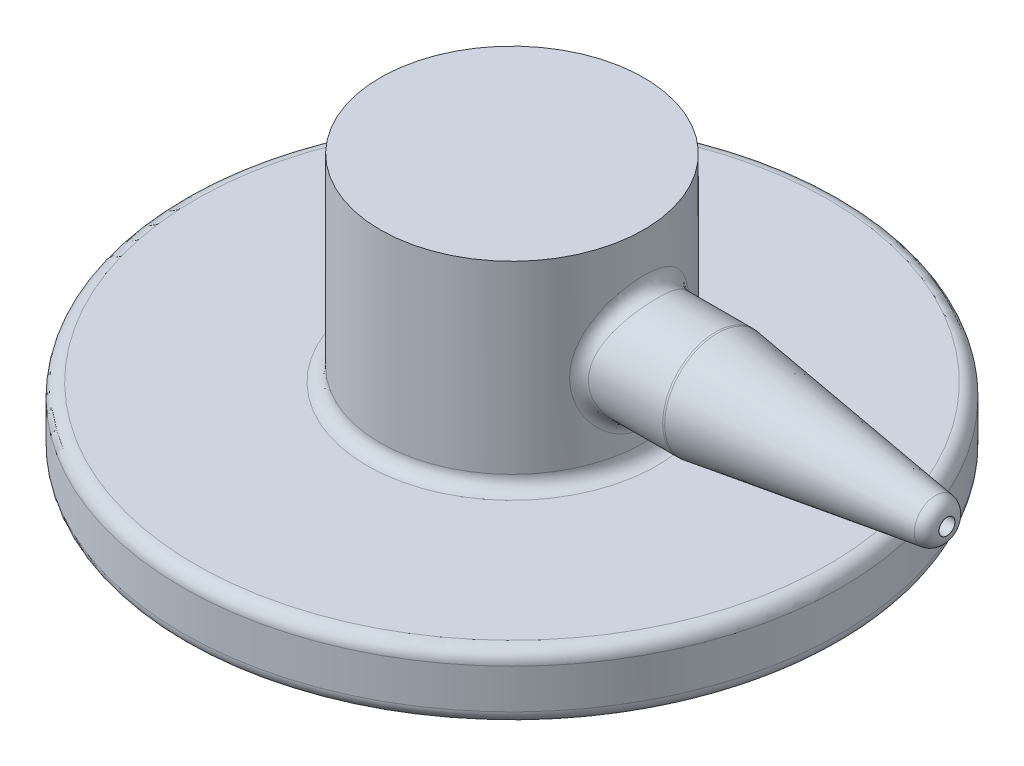
from build123d import *

# Parameters (mm, degrees)
SKETCH3_R               = 4
BOSS_EXTRUDE1_DEPTH     = 25
BOSS_EXTRUDE2_START     = 25
SKETCH3_5_R             = 3
BOSS_EXTRUDE2_DEPTH     = 8
FILLET1_R               = 1
CUT_EXTRUDE1_DEPTH      = 17
CUT_EXTRUDE1_DEPTH_BACK = 46.978255774
SKETCH15_R              = 1.8
FILLET3_R               = 1


with BuildPart() as part:
    # Sketch1 → Revolve1 (revolve)
    with BuildSketch(Plane.XY, mode=Mode.PRIVATE) as revolve1_sk:
        Polygon((0, 20), (0, 0), (25, 0), (25, 5), (10, 5), (10, 20), align=None)
    revolve(revolve1_sk.sketch.rotate(Axis((0, 20, 0), (0, -1, 0)), 90), axis=Axis((0, 20, 0), (0, -1, 0)))

    # Sketch3 → Boss-Extrude1 (add)
    with BuildSketch(Plane(origin=(0, 0, 0), x_dir=(0, 0, -1), z_dir=(1, 0, 0))):
        with Locations(Location((0, 12, 0), (0, 0, 180))):
            Circle(SKETCH3_R)
    extrude(amount=BOSS_EXTRUDE1_DEPTH)

    # Sketch3<5> → Boss-Extrude2 (add)
    with BuildSketch(Plane(origin=(0, 0, 0), x_dir=(0, 0, -1), z_dir=(1, 0, 0)).offset(BOSS_EXTRUDE2_START)):
        with Locations((0, 12)):
            Circle(SKETCH3_5_R)
    extrude(amount=BOSS_EXTRUDE2_DEPTH)

    # Fillet1
    fillet1_edges = [part.edges().sort_by_distance(p)[0] for p in [
        (0, 5, -25),
        (0, 0, -25),
    ]]
    fillet(fillet1_edges, radius=FILLET1_R)

    # Sketch11 → Cut-Revolve10 (revolve, cut)
    with BuildSketch(Plane.XY, mode=Mode.PRIVATE) as cut_revolve10_sk:
        with BuildLine():
            Line((0, 4), (0, 0))
            Line((0, 0), (22.072872435, 0))
            ThreePointArc((22.072872435, 0), (11.216213299, 2.992049146), (0, 4))
        make_face()
    revolve(cut_revolve10_sk.sketch.rotate(Axis((0, 0, 0), (0, 1, 0)), 90), axis=Axis((0, 0, 0), (0, 1, 0)), mode=Mode.SUBTRACT)

    # Sketch15 → Cut-Extrude1 (cut, two sides: drawn at the far end of the back side and taken through both)
    with BuildSketch(Plane(origin=(0, 0, 0), x_dir=(1, 0, 0), z_dir=(0, 1, 0)).offset(-CUT_EXTRUDE1_DEPTH_BACK)):
        with Locations(Location((0, 0, 0), (0, 0, 270))):
            Circle(SKETCH15_R)
    extrude(amount=CUT_EXTRUDE1_DEPTH + CUT_EXTRUDE1_DEPTH_BACK, mode=Mode.SUBTRACT)

    # Sketch16 → Cut-Revolve12 (revolve, cut)
    with BuildSketch(Plane.XY, mode=Mode.PRIVATE) as cut_revolve12_sk:
        Polygon((33, 15), (33, 13.5), (15.503373698, 16), (33, 16), align=None)
    revolve(cut_revolve12_sk.sketch.rotate(Axis((33, 12, 0), (-1, 0, 0)), 270), axis=Axis((33, 12, 0), (-1, 0, 0)), mode=Mode.SUBTRACT)

    # Sketch17 → Cut-Revolve13 (revolve, cut)
    with BuildSketch(Plane.XY, mode=Mode.PRIVATE) as cut_revolve13_sk:
        Polygon((33, 12.6), (33, 12), (0, 12), (0, 14.8), (15.503373698, 14.8), (30.900404844, 12.6), align=None)
    revolve(cut_revolve13_sk.sketch.rotate(Axis((33, 12, 0), (-1, 0, 0)), 90), axis=Axis((33, 12, 0), (-1, 0, 0)), mode=Mode.SUBTRACT)

    # Fillet3
    fillet3_edges = [part.edges().sort_by_distance(p)[0] for p in [
        (9.16515139, 12, -4),
        (15.503373698, 12, -4),
        (33, 12, -1.5),
        (0, 5, -10),
    ]]
    fillet(fillet3_edges, radius=FILLET3_R)


solid = part.part
